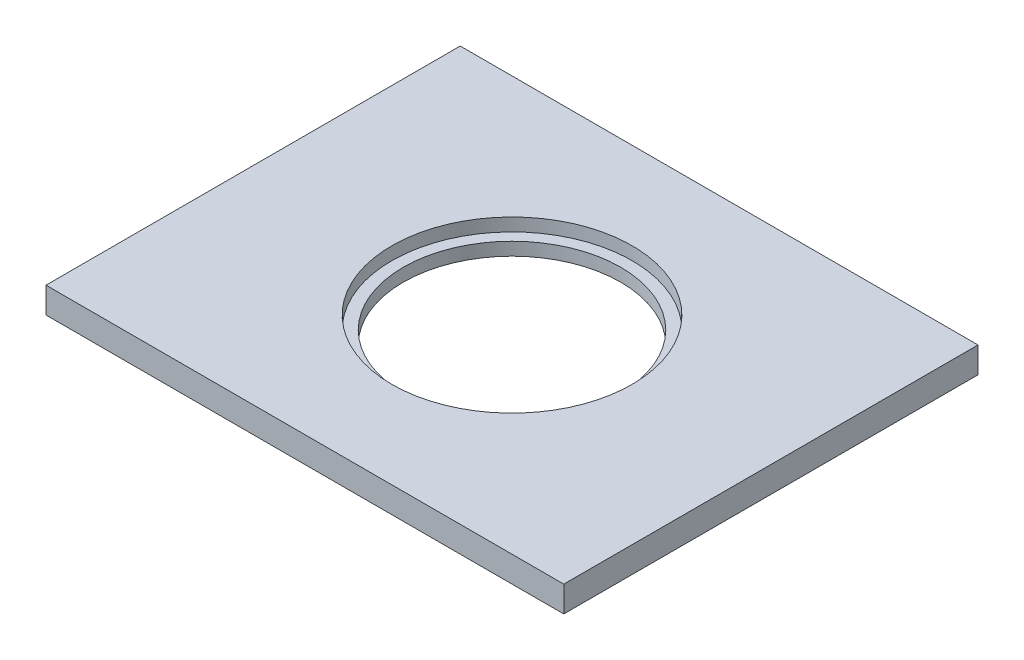
from build123d import *

# Parameters (mm, degrees)
SKETCH1_W           = 100
SKETCH1_H           = 80
BOSS_EXTRUDE1_DEPTH = 5
SKETCH2_R           = 21
CUT_EXTRUDE1_DEPTH  = 8
SKETCH3_R           = 23.2
CUT_EXTRUDE2_DEPTH  = 2.5


with BuildPart() as part:
    # Sketch1 → Boss-Extrude1 (new body)
    with BuildSketch(Plane(origin=(0, 0, 0), x_dir=(1, 0, 0), z_dir=(0, 1, 0))):
        Rectangle(SKETCH1_W, SKETCH1_H)
    extrude(amount=BOSS_EXTRUDE1_DEPTH)

    # Sketch2 → Cut-Extrude1 (cut)
    with BuildSketch(Plane(origin=(0, 5, 0), x_dir=(1, 0, 0), z_dir=(0, 1, 0))):
        with Locations(Location((0, 0, 0), (0, 0, 270))):
            Circle(SKETCH2_R)
    extrude(amount=-CUT_EXTRUDE1_DEPTH, mode=Mode.SUBTRACT)

    # Sketch3 → Cut-Extrude2 (cut)
    with BuildSketch(Plane(origin=(0, 5, 0), x_dir=(1, 0, 0), z_dir=(0, 1, 0))):
        with Locations(Location((0, 0, 0), (0, 0, 270))):
            Circle(SKETCH3_R)
    extrude(amount=-CUT_EXTRUDE2_DEPTH, mode=Mode.SUBTRACT)


solid = part.part
